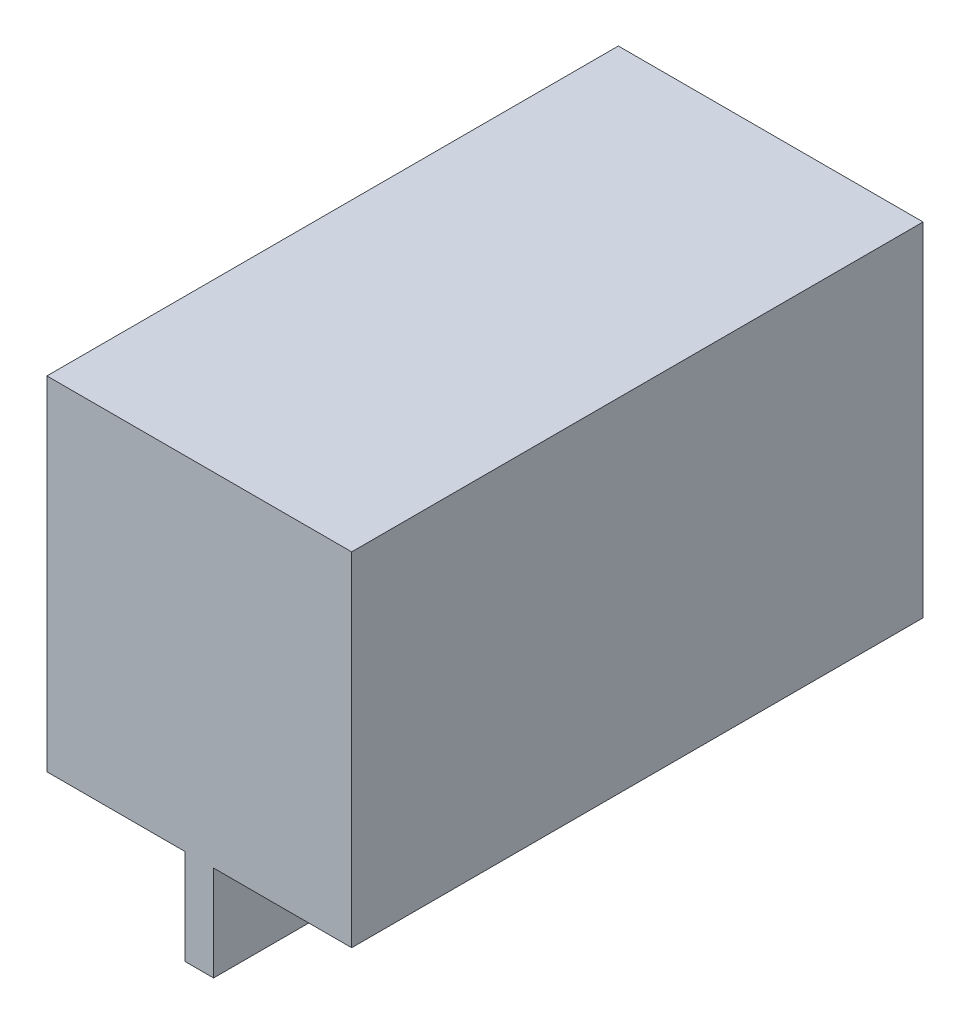
from build123d import *

# Parameters (mm, degrees)
SKETCH_1_W      = 16
SKETCH_1_H      = 30
EXTRUDE_1_DEPTH = 18
EXTRUDE_2_DEPTH = 5


with BuildPart() as part:
    # Эскиз1 → Бобышка-Вытянуть1 (new body)
    with BuildSketch(Plane(origin=(0, 0, 0), x_dir=(1, 0, 0), z_dir=(0, 1, 0))):
        with Locations((8, 15)):
            Rectangle(SKETCH_1_W, SKETCH_1_H)
    extrude(amount=EXTRUDE_1_DEPTH)

    # Эскиз2 → Бобышка-Вытянуть2 (add)
    with BuildSketch(Plane.XZ):
        Polygon((7.25, -15), (7.25, 0), (8.75, 0), (8.75, -15), (8.75, -30), (7.25, -30), align=None)
    extrude(amount=EXTRUDE_2_DEPTH)


solid = part.part
